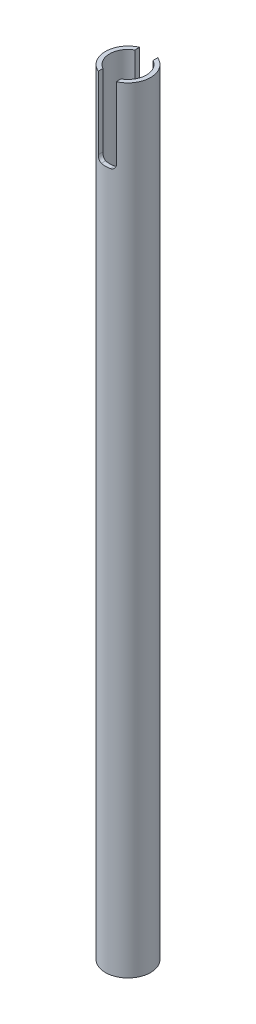
from build123d import *
from build123d.topology import SkipClean

# Parameters (mm, degrees)
SKETCH1_R                = 7.9375
SKETCH1_R_2              = 6.4643
BOSS_EXTRUDE1_DEPTH      = 25.4
BOSS_EXTRUDE2_DEPTH      = 141.62245
BOSS_EXTRUDE2_DEPTH_BACK = 130.68677
SKETCH1_3_R              = 7.9375
SKETCH1_3_R_2            = 6.4643
CUT_EXTRUDE1_DEPTH       = 643.973080375


with BuildPart() as part:
    # Sketch1 → Boss-Extrude1 (new body)
    with BuildSketch(Plane(origin=(0, 0, 0), x_dir=(1, 0, 0), z_dir=(0, 1, 0))):
        with Locations(Location((0, 0, 0), (0, 0, 270))):
            Circle(SKETCH1_R)
        with Locations(Location((0, 0, 0), (0, 0, 270))):
            Circle(SKETCH1_R_2, mode=Mode.SUBTRACT)
    extrude(amount=BOSS_EXTRUDE1_DEPTH)

    # Sketch1<3> → Boss-Extrude2 (add, two sides: drawn at the far end of the back side and taken through both)
    with SkipClean():  # the faces are left unmerged after this step: merging them gives an invalid solid
        with BuildSketch(Plane(origin=(0, 0, 0), x_dir=(1, 0, 0), z_dir=(0, 1, 0)).offset(-BOSS_EXTRUDE2_DEPTH_BACK)):
            with Locations(Location((0, 0, 0), (0, 0, 90))):
                Circle(SKETCH1_3_R)
            with Locations(Location((0, 0, 0), (0, 0, 90))):
                Circle(SKETCH1_3_R_2, mode=Mode.SUBTRACT)
        extrude(amount=BOSS_EXTRUDE2_DEPTH + BOSS_EXTRUDE2_DEPTH_BACK)

    # Sketch4 → Cut-Extrude1 (cut, through all)
    with SkipClean():  # the faces are left unmerged after this step: merging them gives an invalid solid
        with BuildSketch(Plane(origin=(282.84484953, -431.620946529, -7.9375), x_dir=(0.8492193826528428, 0.5280401879845174, 0), z_dir=(0, 0, 1))):
            with BuildLine():
                Line((65.194493974, 634.486323351), (51.782273199, 612.916151031))
                ThreePointArc((51.782273199, 612.916151031), (50.794671358, 612.208396868), (49.595873631, 612.40627906))
                Line((49.595873631, 612.40627906), (46.899602091, 614.082806656))
                ThreePointArc((46.899602091, 614.082806656), (46.191847928, 615.070408498), (46.38973012, 616.269206225))
                Line((46.38973012, 616.269206225), (59.801950894, 637.839378544))
                Line((59.801950894, 637.839378544), (65.194493974, 634.486323351))
            make_face()
        extrude(amount=CUT_EXTRUDE1_DEPTH, mode=Mode.SUBTRACT)


solid = part.part
